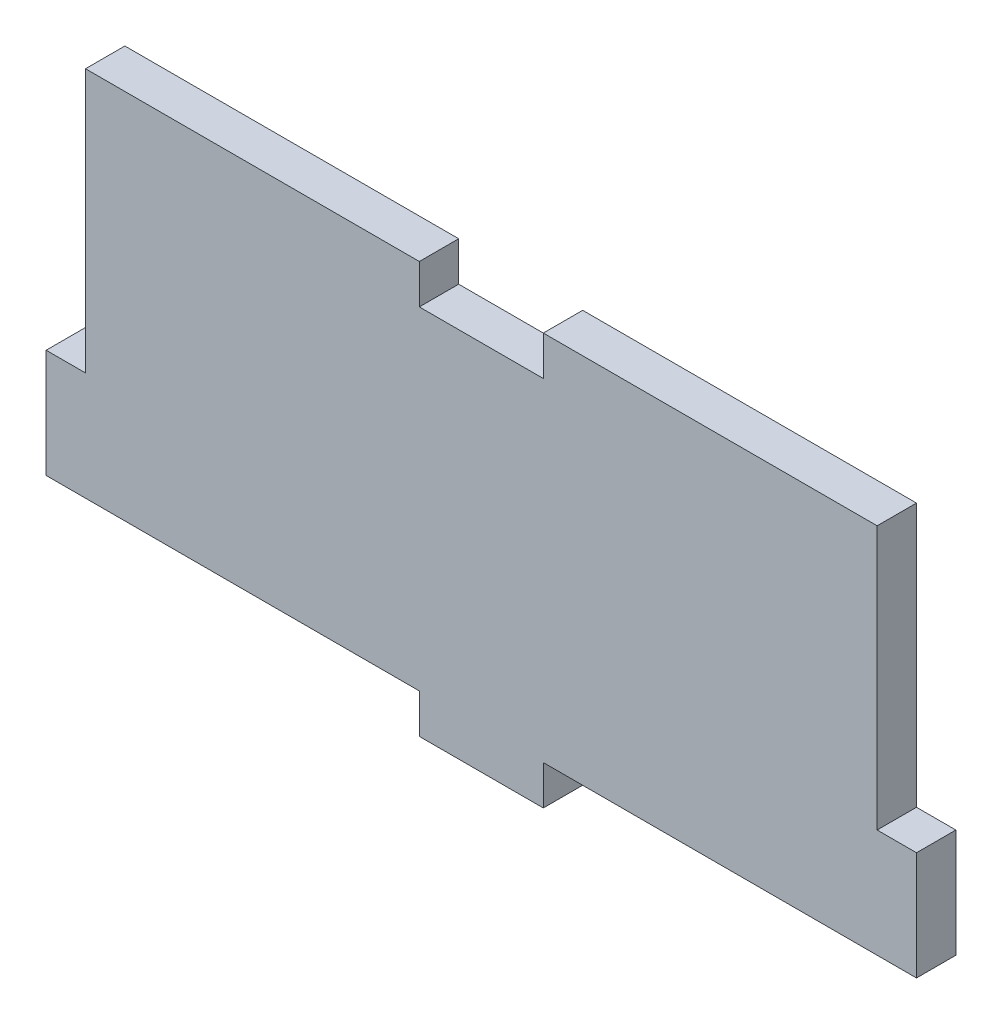
from build123d import *

# Parameters (mm, degrees)
SKETCH3_W           = 12.7
SKETCH3_H           = 35
SKETCH3_W_2         = 40
SKETCH3_H_2         = 12.7
BOSS_EXTRUDE1_DEPTH = 12.7
SKETCH4_W           = 40
SKETCH4_H           = 12.7
CUT_EXTRUDE1_DEPTH  = 12.7


with BuildPart() as part:
    # Sketch3 → Boss-Extrude1 (new body)
    with BuildSketch(Plane.XY):
        Polygon((127.7, 60), (-127.7, 60), (-127.7, -25), (-127.7, -60), (-20, -60), (20, -60), (127.7, -60), (127.7, -25), align=None)
        with Locations((-134.05, -42.5)):
            Rectangle(SKETCH3_W, SKETCH3_H)
        with Locations((134.05, -42.5)):
            Rectangle(SKETCH3_W, SKETCH3_H)
        with Locations((0, -66.35)):
            Rectangle(SKETCH3_W_2, SKETCH3_H_2)
    extrude(amount=BOSS_EXTRUDE1_DEPTH)

    # Sketch4 → Cut-Extrude1 (cut)
    with BuildSketch(Plane.XY.offset(12.7)):
        with Locations((0, 53.65)):
            Rectangle(SKETCH4_W, SKETCH4_H)
    extrude(amount=-CUT_EXTRUDE1_DEPTH, mode=Mode.SUBTRACT)


solid = part.part
